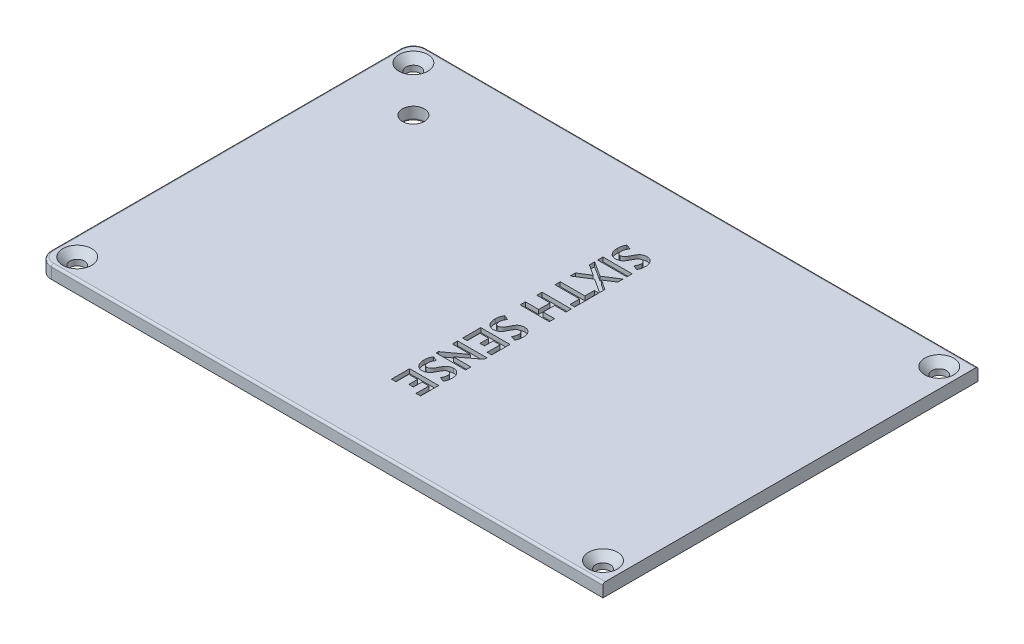
from build123d import *

# Parameters (mm, degrees)
SKETCH1_W                    = 131
SKETCH1_H                    = 87
BOSS_EXTRUDE1_DEPTH          = 1.5
CSK_FOR_M3_SFHCS1_AT_2_COUNT = 2
CSK_FOR_M3_SFHCS1_AT_2_PITCH = 78
CSK_FOR_M3_SFHCS1_AT_3_COUNT = 2
CSK_FOR_M3_SFHCS1_AT_3_PITCH = 144.803314879
CSK_FOR_M3_SFHCS1_AT_4_COUNT = 2
CSK_FOR_M3_SFHCS1_AT_4_PITCH = 122
SKETCH5_R                    = 2.55
CUT_EXTRUDE1_DEPTH           = 79.686085174
FILLET3_R                    = 0.5
SKETCH6_W                    = 6.762722439
SKETCH6_H                    = 1.229585898
CUT_EXTRUDE2_DEPTH           = 1
FILLET4_R                    = 3
FILLET5_R                    = 0.5


with BuildPart() as part:
    # Sketch1 → Boss-Extrude1 (new, symmetric)
    with BuildSketch(Plane(origin=(0, 0, 0), x_dir=(1, 0, 0), z_dir=(0, 1, 0))):
        Rectangle(SKETCH1_W, SKETCH1_H)
    extrude(amount=BOSS_EXTRUDE1_DEPTH, both=True)

    # Sketch4 → CSK for M3 SFHCS1 (revolve, cut)
    with BuildSketch(Plane(origin=(-61, 1.5, -39), x_dir=(0, 0, 1), z_dir=(1, 0, 0))):
        Polygon((0, 0), (0, 3), (1.7, 3), (1.7, 1.66), (3.36, 0), align=None)
    csk_for_m3_sfhcs1 = revolve(axis=Axis((-61, 7.85, -39), (0, -1, 0)), mode=Mode.SUBTRACT)

    # CSK for M3 SFHCS1 at 2: CSK for M3 SFHCS1 ×2
    with Locations(*[(0, 0, i * CSK_FOR_M3_SFHCS1_AT_2_PITCH) for i in range(1, CSK_FOR_M3_SFHCS1_AT_2_COUNT)]):
        add(csk_for_m3_sfhcs1, mode=Mode.SUBTRACT)

    # CSK for M3 SFHCS1 at 3: CSK for M3 SFHCS1 ×2
    with Locations(*[Vector(0.8425221487628959, 0, 0.5386617016680811) * (i * CSK_FOR_M3_SFHCS1_AT_3_PITCH) for i in range(1, CSK_FOR_M3_SFHCS1_AT_3_COUNT)]):
        add(csk_for_m3_sfhcs1, mode=Mode.SUBTRACT)

    # CSK for M3 SFHCS1 at 4: CSK for M3 SFHCS1 ×2
    with Locations(*[(i * CSK_FOR_M3_SFHCS1_AT_4_PITCH, 0, 0) for i in range(1, CSK_FOR_M3_SFHCS1_AT_4_COUNT)]):
        add(csk_for_m3_sfhcs1, mode=Mode.SUBTRACT)

    # Sketch5 → Cut-Extrude1 (cut, through all)
    with BuildSketch(Plane(origin=(0, 1.5, 0), x_dir=(1, 0, 0), z_dir=(0, 1, 0))):
        with Locations(Location((-50.5, 28.5, 0), (0, 0, 270))):
            Circle(SKETCH5_R)
    extrude(amount=-CUT_EXTRUDE1_DEPTH, mode=Mode.SUBTRACT)

    # Fillet3
    fillet3_edges = [part.edges().sort_by_distance(p)[0] for p in [
        (-50.5, -1.5, -31.05),
    ]]
    fillet(fillet3_edges, radius=FILLET3_R)

    # Sketch6 → Cut-Extrude2 (cut)
    with BuildSketch(Plane(origin=(0, 1.5, 0), x_dir=(1, 0, 0), z_dir=(0, 1, 0))):
        with BuildLine():
            Line((0.406202484, 27.182631103), (1.49306859, 26.739376365))
            add(Edge.make_bspline(
                [(1.49306859, 26.739376365), (1.451060698, 26.680928639), (1.368792763, 26.566465061), (1.26222519, 26.389008384), (1.170583404, 26.212893324), (1.096407357, 26.037079675), (1.038197761, 25.862314249), (0.996753307, 25.688342194), (0.970908871, 25.514686568), (0.967700298, 25.398720088), (0.966103206, 25.340996867)],
                knots=[0, 0, 0, 0, 1.136007301, 2.224747964, 3.264852221, 4.268199212, 5.234281408, 6.169723066, 7.088965376, 8, 8, 8, 8], degree=3))
            add(Edge.make_bspline(
                [(0.966103206, 25.340996867), (0.966639685, 25.29844729), (0.967679109, 25.216007943), (0.975413127, 25.095857576), (0.991112368, 24.984271883), (1.009318959, 24.880302518), (1.035554037, 24.785355631), (1.067531045, 24.699016346), (1.102048587, 24.618995415), (1.147400367, 24.549650023), (1.194339423, 24.485719752), (1.248915921, 24.431139206), (1.309491409, 24.38630681), (1.374984108, 24.348112967), (1.446770748, 24.31962439), (1.524152146, 24.2990936), (1.607017728, 24.286516132), (1.664104215, 24.285066204), (1.693425221, 24.284321486)],
                knots=[0, 0, 0, 0, 1.401841713, 2.716053132, 3.962869092, 5.112648236, 6.191186144, 7.201893328, 8.146031284, 9.053370396, 9.924442017, 10.755622299, 11.584476831, 12.401325343, 13.246460079, 14.120135028, 15.034455693, 16, 16, 16, 16], degree=3))
            add(Edge.make_bspline(
                [(1.693425221, 24.284321486), (1.750079425, 24.28691381), (1.863639895, 24.29210999), (2.029550149, 24.34484128), (2.192463764, 24.421809608), (2.322558495, 24.513717075), (2.425178797, 24.60740506), (2.505812559, 24.69604494), (2.589495448, 24.800343015), (2.674201792, 24.921969072), (2.761874097, 25.059431468), (2.852468863, 25.212997728), (2.944004992, 25.383747509), (3.036181592, 25.565959993), (3.125218667, 25.749964235), (3.216621044, 25.920636033), (3.301160036, 26.077018458), (3.383559625, 26.216041169), (3.459996448, 26.340161777), (3.532794568, 26.448115022), (3.602282068, 26.539494871), (3.688138749, 26.640873514), (3.800498416, 26.747895184), (3.943401171, 26.861927268), (4.100019614, 26.958165656), (4.267428916, 27.038834692), (4.4453598, 27.104579727), (4.633504574, 27.148483504), (4.830548805, 27.177266557), (4.964896301, 27.180815672), (5.03361727, 27.182631103)],
                knots=[0, 0, 0, 0, 1.007299351, 2.019080297, 3.077118061, 4.213121693, 4.842470732, 5.552493502, 6.347401472, 7.225468917, 8.193906372, 9.254299695, 10.403955714, 11.647898709, 12.895473506, 14.048481298, 15.099832135, 16.065104079, 16.929732481, 17.698947541, 18.385773577, 18.975893792, 20.0661414, 21.146426602, 22.230677068, 23.336076148, 24.455976316, 25.605429759, 26.775137678, 28, 28, 28, 28], degree=3))
            add(Edge.make_bspline(
                [(5.03361727, 27.182631103), (5.097742256, 27.18062916), (5.22332768, 27.176708459), (5.407950359, 27.150441727), (5.583749307, 27.105274761), (5.751506362, 27.041243327), (5.911050633, 26.960432483), (6.062182492, 26.860634244), (6.203188675, 26.74160486), (6.335955733, 26.60788024), (6.456356714, 26.459882115), (6.562791017, 26.300325063), (6.651528005, 26.129757444), (6.725494661, 25.94949257), (6.781056399, 25.758914882), (6.820553846, 25.558194292), (6.846184974, 25.347603991), (6.849073436, 25.20338554), (6.850550003, 25.129661791)],
                knots=[0, 0, 0, 0, 1.003085556, 1.964490506, 2.910404148, 3.836734481, 4.768026743, 5.702831464, 6.663037238, 7.649755293, 8.64667032, 9.64299446, 10.644854062, 11.649469957, 12.686516093, 13.74467873, 14.84709108, 16, 16, 16, 16], degree=3))
            add(Edge.make_bspline(
                [(6.850550003, 25.129661791), (6.849282159, 25.034940665), (6.846835104, 24.852120249), (6.826767079, 24.587527634), (6.790575351, 24.342974118), (6.744126247, 24.116685217), (6.680394544, 23.910406447), (6.605587743, 23.722231023), (6.516079834, 23.553107756), (6.44195876, 23.45415445), (6.40592296, 23.406045845)],
                knots=[0, 0, 0, 0, 1.254174961, 2.420672123, 3.510267823, 4.525993671, 5.476313664, 6.364885099, 7.205048305, 8, 8, 8, 8], degree=3))
            Line((6.40592296, 23.406045845), (5.357481413, 23.766962241))
            add(Edge.make_bspline(
                [(5.357481413, 23.766962241), (5.392596173, 23.81906428), (5.461942779, 23.921958321), (5.550608739, 24.082968582), (5.626600455, 24.245141428), (5.688862247, 24.409282435), (5.737139041, 24.575865514), (5.771218197, 24.744775686), (5.792739106, 24.915940589), (5.795321759, 25.030792979), (5.796619234, 25.088492621)],
                knots=[0, 0, 0, 0, 1.065306581, 2.103827425, 3.113989297, 4.101151914, 5.078507631, 6.052407603, 7.021566866, 8, 8, 8, 8], degree=3))
            add(Edge.make_bspline(
                [(5.796619234, 25.088492621), (5.794168994, 25.153661255), (5.789526802, 25.277128913), (5.749869292, 25.451777373), (5.680658704, 25.602846957), (5.584926002, 25.729206663), (5.468104007, 25.82947978), (5.333590596, 25.902379752), (5.181773991, 25.946280366), (5.07508475, 25.950738832), (5.019894213, 25.953045205)],
                knots=[0, 0, 0, 0, 1.191848157, 2.258060239, 3.254500576, 4.210660285, 5.136954709, 6.051060518, 6.991810101, 8, 8, 8, 8], degree=3))
            add(Edge.make_bspline(
                [(5.019894213, 25.953045205), (4.971290184, 25.948700173), (4.87009389, 25.939653575), (4.721130463, 25.873271238), (4.573630958, 25.768747461), (4.424872882, 25.624501793), (4.276303466, 25.439999622), (4.12560074, 25.216056249), (3.973783292, 24.951967842), (3.878834428, 24.759269525), (3.828732874, 24.657588634)],
                knots=[0, 0, 0, 0, 0.634420533, 1.320898859, 2.099052417, 2.991721158, 4.020274054, 5.191524251, 6.518054955, 8, 8, 8, 8], degree=3))
            add(Edge.make_bspline(
                [(3.828732874, 24.657588634), (3.801939633, 24.60260168), (3.749874534, 24.495750063), (3.67118765, 24.342405803), (3.591901355, 24.202311173), (3.517159255, 24.072264204), (3.441633348, 23.955196737), (3.369247523, 23.848861411), (3.298035831, 23.755181164), (3.205113446, 23.647993276), (3.084873077, 23.52884348), (2.929991075, 23.403363219), (2.76249345, 23.297314812), (2.584779241, 23.208765881), (2.395523041, 23.139928396), (2.195830387, 23.091075486), (1.98535845, 23.059467839), (1.841294043, 23.056338092), (1.767529728, 23.054735588)],
                knots=[0, 0, 0, 0, 1.052076341, 2.044413247, 2.963730473, 3.820594687, 4.623762047, 5.359219194, 6.032729248, 6.646314003, 7.797940816, 8.939444724, 10.067858809, 11.200844217, 12.34827075, 13.52373162, 14.73209321, 16, 16, 16, 16], degree=3))
            add(Edge.make_bspline(
                [(1.767529728, 23.054735588), (1.701516125, 23.05626675), (1.571442494, 23.059283762), (1.38150153, 23.092533933), (1.199860181, 23.142911532), (1.027440717, 23.214717961), (0.864253006, 23.307285013), (0.711445445, 23.42133194), (0.565957669, 23.554031363), (0.431403321, 23.7069431), (0.309212511, 23.877518639), (0.202041591, 24.062519517), (0.112766412, 24.262479767), (0.038353803, 24.474802474), (-0.017270218, 24.702022622), (-0.058335708, 24.942265837), (-0.083370092, 25.196833462), (-0.086317962, 25.371130242), (-0.087827564, 25.460387462)],
                knots=[0, 0, 0, 0, 0.930401173, 1.833268491, 2.711750648, 3.585455244, 4.461159603, 5.351765821, 6.269910703, 7.234595455, 8.219615877, 9.225803062, 10.245394606, 11.304653431, 12.395600179, 13.541437022, 14.740972164, 16, 16, 16, 16], degree=3))
            add(Edge.make_bspline(
                [(-0.087827564, 25.460387462), (-0.086190768, 25.539125064), (-0.082957515, 25.694659749), (-0.058874425, 25.924836778), (-0.02054526, 26.149044867), (0.032680534, 26.368085752), (0.103255024, 26.581124016), (0.188291788, 26.788492426), (0.288447906, 26.990091967), (0.366811534, 27.118223421), (0.406202484, 27.182631103)],
                knots=[0, 0, 0, 0, 1.040147641, 2.054660472, 3.05421144, 4.043643693, 5.029821955, 6.016352017, 7.002882079, 8, 8, 8, 8], degree=3))
        make_face()
        with Locations((3.38136122, 21.38601187)):
            Rectangle(SKETCH6_W, SKETCH6_H)
        Polygon((0, 15.589392636), (2.527787081, 17.197734904), (0, 18.839012509), (0, 20.068598407), (3.489773369, 17.809783242), (6.762722439, 19.892943279), (6.758605522, 18.663357381), (4.454504269, 17.185384153), (6.762722439, 15.6772202), (6.762722439, 14.447634302), (3.489773369, 16.573335815), (0, 14.359806738), align=None)
        Polygon((5.708791669, 10.846704172), (0, 10.846704172), (0, 12.07629007), (5.708791669, 12.07629007), (5.708791669, 14.271979174), (6.762722439, 14.271979174), (6.762722439, 8.651015068), (5.708791669, 8.651015068), align=None)
        Polygon((0, 3.996154169), (3.073964745, 3.996154169), (3.073964745, 6.630981093), (0, 6.630981093), (0, 7.860566991), (6.762722439, 7.860566991), (6.762722439, 6.630981093), (4.127895515, 6.630981093), (4.127895515, 3.996154169), (6.762722439, 3.996154169), (6.762722439, 2.766568271), (0, 2.766568271), align=None)
        with BuildLine():
            Line((0.406202484, -1.185672116), (1.49306859, -1.628926854))
            add(Edge.make_bspline(
                [(1.49306859, -1.628926854), (1.451060698, -1.68737458), (1.368792763, -1.801838158), (1.26222519, -1.979294835), (1.170583404, -2.155409895), (1.096407357, -2.331223544), (1.038197761, -2.50598897), (0.996753307, -2.679961025), (0.970908871, -2.853616651), (0.967700298, -2.969583131), (0.966103206, -3.027306352)],
                knots=[0, 0, 0, 0, 1.136007301, 2.224747964, 3.264852221, 4.268199212, 5.234281408, 6.169723066, 7.088965376, 8, 8, 8, 8], degree=3))
            add(Edge.make_bspline(
                [(0.966103206, -3.027306352), (0.966639685, -3.06985593), (0.967679109, -3.152295276), (0.975413127, -3.272445643), (0.991112368, -3.384031336), (1.009318959, -3.488000701), (1.035554037, -3.582947588), (1.067531045, -3.669286873), (1.102048587, -3.749307804), (1.147400367, -3.818653196), (1.194339423, -3.882583467), (1.248915921, -3.937164013), (1.309491409, -3.981996409), (1.374984108, -4.020190252), (1.446770748, -4.048678829), (1.524152146, -4.069209619), (1.607017728, -4.081787087), (1.664104215, -4.083237015), (1.693425221, -4.083981733)],
                knots=[0, 0, 0, 0, 1.401841713, 2.716053132, 3.962869092, 5.112648236, 6.191186144, 7.201893328, 8.146031284, 9.053370396, 9.924442017, 10.755622299, 11.584476831, 12.401325343, 13.246460079, 14.120135028, 15.034455693, 16, 16, 16, 16], degree=3))
            add(Edge.make_bspline(
                [(1.693425221, -4.083981733), (1.750079425, -4.08138941), (1.863639895, -4.076193229), (2.029550149, -4.023461939), (2.192463764, -3.946493611), (2.322558495, -3.854586144), (2.425178797, -3.760898159), (2.505812559, -3.672258279), (2.589495448, -3.567960204), (2.674201792, -3.446334147), (2.761874097, -3.308871751), (2.852468863, -3.155305491), (2.944004992, -2.98455571), (3.036181592, -2.802343226), (3.125218667, -2.618338984), (3.216621044, -2.447667186), (3.301160036, -2.291284761), (3.383559625, -2.15226205), (3.459996448, -2.028141442), (3.532794568, -1.920188197), (3.602282068, -1.828808348), (3.688138749, -1.727429705), (3.800498416, -1.620408035), (3.943401171, -1.506375951), (4.100019614, -1.410137563), (4.267428916, -1.329468527), (4.4453598, -1.263723492), (4.633504574, -1.219819715), (4.830548805, -1.191036662), (4.964896301, -1.187487547), (5.03361727, -1.185672116)],
                knots=[0, 0, 0, 0, 1.007299351, 2.019080297, 3.077118061, 4.213121693, 4.842470732, 5.552493502, 6.347401472, 7.225468917, 8.193906372, 9.254299695, 10.403955714, 11.647898709, 12.895473506, 14.048481298, 15.099832135, 16.065104079, 16.929732481, 17.698947541, 18.385773577, 18.975893792, 20.0661414, 21.146426602, 22.230677068, 23.336076148, 24.455976316, 25.605429759, 26.775137678, 28, 28, 28, 28], degree=3))
            add(Edge.make_bspline(
                [(5.03361727, -1.185672116), (5.097742256, -1.187674059), (5.22332768, -1.19159476), (5.407950359, -1.217861492), (5.583749307, -1.263028458), (5.751506362, -1.327059892), (5.911050633, -1.407870736), (6.062182492, -1.507668975), (6.203188675, -1.626698359), (6.335955733, -1.760422979), (6.456356714, -1.908421104), (6.562791017, -2.067978156), (6.651528005, -2.238545775), (6.725494661, -2.41881065), (6.781056399, -2.609388337), (6.820553846, -2.810108927), (6.846184974, -3.020699228), (6.849073436, -3.164917679), (6.850550003, -3.238641428)],
                knots=[0, 0, 0, 0, 1.003085556, 1.964490506, 2.910404148, 3.836734481, 4.768026743, 5.702831464, 6.663037238, 7.649755293, 8.64667032, 9.64299446, 10.644854062, 11.649469957, 12.686516093, 13.74467873, 14.84709108, 16, 16, 16, 16], degree=3))
            add(Edge.make_bspline(
                [(6.850550003, -3.238641428), (6.849282159, -3.333362554), (6.846835104, -3.51618297), (6.826767079, -3.780775585), (6.790575351, -4.025329101), (6.744126247, -4.251618002), (6.680394544, -4.457896773), (6.605587743, -4.646072196), (6.516079834, -4.815195463), (6.44195876, -4.914148769), (6.40592296, -4.962257374)],
                knots=[0, 0, 0, 0, 1.254174961, 2.420672123, 3.510267823, 4.525993671, 5.476313664, 6.364885099, 7.205048305, 8, 8, 8, 8], degree=3))
            Line((6.40592296, -4.962257374), (5.357481413, -4.601340978))
            add(Edge.make_bspline(
                [(5.357481413, -4.601340978), (5.392596173, -4.549238939), (5.461942779, -4.446344898), (5.550608739, -4.285334637), (5.626600455, -4.123161792), (5.688862247, -3.959020784), (5.737139041, -3.792437705), (5.771218197, -3.623527533), (5.792739106, -3.45236263), (5.795321759, -3.33751024), (5.796619234, -3.279810599)],
                knots=[0, 0, 0, 0, 1.065306581, 2.103827425, 3.113989297, 4.101151914, 5.078507631, 6.052407603, 7.021566866, 8, 8, 8, 8], degree=3))
            add(Edge.make_bspline(
                [(5.796619234, -3.279810599), (5.794168994, -3.214641965), (5.789526802, -3.091174306), (5.749869292, -2.916525847), (5.680658704, -2.765456263), (5.584926002, -2.639096556), (5.468104007, -2.538823439), (5.333590596, -2.465923467), (5.181773991, -2.422022853), (5.07508475, -2.417564387), (5.019894213, -2.415258014)],
                knots=[0, 0, 0, 0, 1.191848157, 2.258060239, 3.254500576, 4.210660285, 5.136954709, 6.051060518, 6.991810101, 8, 8, 8, 8], degree=3))
            add(Edge.make_bspline(
                [(5.019894213, -2.415258014), (4.971290184, -2.419603046), (4.87009389, -2.428649644), (4.721130463, -2.495031981), (4.573630958, -2.599555758), (4.424872882, -2.743801426), (4.276303466, -2.928303597), (4.12560074, -3.152246971), (3.973783292, -3.416335377), (3.878834428, -3.609033694), (3.828732874, -3.710714585)],
                knots=[0, 0, 0, 0, 0.634420533, 1.320898859, 2.099052417, 2.991721158, 4.020274054, 5.191524251, 6.518054955, 8, 8, 8, 8], degree=3))
            add(Edge.make_bspline(
                [(3.828732874, -3.710714585), (3.801939633, -3.76570154), (3.749874534, -3.872553157), (3.67118765, -4.025897416), (3.591901355, -4.165992047), (3.517159255, -4.296039016), (3.441633348, -4.413106482), (3.369247523, -4.519441809), (3.298035831, -4.613122055), (3.205113446, -4.720309943), (3.084873077, -4.839459739), (2.929991075, -4.96494), (2.76249345, -5.070988407), (2.584779241, -5.159537338), (2.395523041, -5.228374823), (2.195830387, -5.277227733), (1.98535845, -5.30883538), (1.841294043, -5.311965128), (1.767529728, -5.313567631)],
                knots=[0, 0, 0, 0, 1.052076341, 2.044413247, 2.963730473, 3.820594687, 4.623762047, 5.359219194, 6.032729248, 6.646314003, 7.797940816, 8.939444724, 10.067858809, 11.200844217, 12.34827075, 13.52373162, 14.73209321, 16, 16, 16, 16], degree=3))
            add(Edge.make_bspline(
                [(1.767529728, -5.313567631), (1.701516125, -5.312036469), (1.571442494, -5.309019458), (1.38150153, -5.275769286), (1.199860181, -5.225391687), (1.027440717, -5.153585258), (0.864253006, -5.061018207), (0.711445445, -4.946971279), (0.565957669, -4.814271856), (0.431403321, -4.661360119), (0.309212511, -4.49078458), (0.202041591, -4.305783703), (0.112766412, -4.105823453), (0.038353803, -3.893500745), (-0.017270218, -3.666280597), (-0.058335708, -3.426037382), (-0.083370092, -3.171469757), (-0.086317962, -2.997172977), (-0.087827564, -2.907915757)],
                knots=[0, 0, 0, 0, 0.930401173, 1.833268491, 2.711750648, 3.585455244, 4.461159603, 5.351765821, 6.269910703, 7.234595455, 8.219615877, 9.225803062, 10.245394606, 11.304653431, 12.395600179, 13.541437022, 14.740972164, 16, 16, 16, 16], degree=3))
            add(Edge.make_bspline(
                [(-0.087827564, -2.907915757), (-0.086190768, -2.829178156), (-0.082957515, -2.67364347), (-0.058874425, -2.443466441), (-0.02054526, -2.219258352), (0.032680534, -2.000217467), (0.103255024, -1.787179203), (0.188291788, -1.579810794), (0.288447906, -1.378211252), (0.366811534, -1.250079798), (0.406202484, -1.185672116)],
                knots=[0, 0, 0, 0, 1.040147641, 2.054660472, 3.05421144, 4.043643693, 5.029821955, 6.016352017, 7.002882079, 8, 8, 8, 8], degree=3))
        make_face()
        Polygon((5.708791669, -7.597084299), (4.127895515, -7.597084299), (4.127895515, -9.617118274), (3.073964745, -9.617118274), (3.073964745, -7.597084299), (1.05393077, -7.597084299), (1.05393077, -10.58322148), (0, -10.58322148), (0, -6.367498401), (6.762722439, -6.367498401), (6.762722439, -10.58322148), (5.708791669, -10.58322148), align=None)
        Polygon((-0.087827564, -16.116358021), (4.215723079, -12.954565712), (0, -12.954565712), (0, -11.724979813), (6.762722439, -11.724979813), (6.762722439, -12.339772763), (2.722654489, -15.413737508), (6.762722439, -15.413737508), (6.762722439, -16.643323406), (-0.087827564, -16.643323406), align=None)
        with BuildLine():
            Line((0.406202484, -17.697254175), (1.49306859, -18.140508913))
            add(Edge.make_bspline(
                [(1.49306859, -18.140508913), (1.451060698, -18.19895664), (1.368792763, -18.313420218), (1.26222519, -18.490876895), (1.170583404, -18.666991955), (1.096407357, -18.842805603), (1.038197761, -19.01757103), (0.996753307, -19.191543085), (0.970908871, -19.365198711), (0.967700298, -19.481165191), (0.966103206, -19.538888411)],
                knots=[0, 0, 0, 0, 1.136007301, 2.224747964, 3.264852221, 4.268199212, 5.234281408, 6.169723066, 7.088965376, 8, 8, 8, 8], degree=3))
            add(Edge.make_bspline(
                [(0.966103206, -19.538888411), (0.966639685, -19.581437989), (0.967679109, -19.663877335), (0.975413127, -19.784027702), (0.991112368, -19.895613396), (1.009318959, -19.999582761), (1.035554037, -20.094529648), (1.067531045, -20.180868932), (1.102048587, -20.260889863), (1.147400367, -20.330235256), (1.194339423, -20.394165526), (1.248915921, -20.448746073), (1.309491409, -20.493578469), (1.374984108, -20.531772311), (1.446770748, -20.560260889), (1.524152146, -20.580791679), (1.607017728, -20.593369146), (1.664104215, -20.594819074), (1.693425221, -20.595563792)],
                knots=[0, 0, 0, 0, 1.401841713, 2.716053132, 3.962869092, 5.112648236, 6.191186144, 7.201893328, 8.146031284, 9.053370396, 9.924442017, 10.755622299, 11.584476831, 12.401325343, 13.246460079, 14.120135028, 15.034455693, 16, 16, 16, 16], degree=3))
            add(Edge.make_bspline(
                [(1.693425221, -20.595563792), (1.750079425, -20.592971469), (1.863639895, -20.587775289), (2.029550149, -20.535043999), (2.192463764, -20.45807567), (2.322558495, -20.366168203), (2.425178797, -20.272480219), (2.505812559, -20.183840339), (2.589495448, -20.079542264), (2.674201792, -19.957916206), (2.761874097, -19.82045381), (2.852468863, -19.666887551), (2.944004992, -19.49613777), (3.036181592, -19.313925286), (3.125218667, -19.129921043), (3.216621044, -18.959249246), (3.301160036, -18.80286682), (3.383559625, -18.663844109), (3.459996448, -18.539723502), (3.532794568, -18.431770256), (3.602282068, -18.340390408), (3.688138749, -18.239011764), (3.800498416, -18.131990095), (3.943401171, -18.01795801), (4.100019614, -17.921719623), (4.267428916, -17.841050586), (4.4453598, -17.775305552), (4.633504574, -17.731401774), (4.830548805, -17.702618721), (4.964896301, -17.699069606), (5.03361727, -17.697254175)],
                knots=[0, 0, 0, 0, 1.007299351, 2.019080297, 3.077118061, 4.213121693, 4.842470732, 5.552493502, 6.347401472, 7.225468917, 8.193906372, 9.254299695, 10.403955714, 11.647898709, 12.895473506, 14.048481298, 15.099832135, 16.065104079, 16.929732481, 17.698947541, 18.385773577, 18.975893792, 20.0661414, 21.146426602, 22.230677068, 23.336076148, 24.455976316, 25.605429759, 26.775137678, 28, 28, 28, 28], degree=3))
            add(Edge.make_bspline(
                [(5.03361727, -17.697254175), (5.097742256, -17.699256119), (5.22332768, -17.703176819), (5.407950359, -17.729443552), (5.583749307, -17.774610518), (5.751506362, -17.838641952), (5.911050633, -17.919452796), (6.062182492, -18.019251034), (6.203188675, -18.138280418), (6.335955733, -18.272005038), (6.456356714, -18.420003164), (6.562791017, -18.579560216), (6.651528005, -18.750127834), (6.725494661, -18.930392709), (6.781056399, -19.120970396), (6.820553846, -19.321690986), (6.846184974, -19.532281288), (6.849073436, -19.676499739), (6.850550003, -19.750223487)],
                knots=[0, 0, 0, 0, 1.003085556, 1.964490506, 2.910404148, 3.836734481, 4.768026743, 5.702831464, 6.663037238, 7.649755293, 8.64667032, 9.64299446, 10.644854062, 11.649469957, 12.686516093, 13.74467873, 14.84709108, 16, 16, 16, 16], degree=3))
            add(Edge.make_bspline(
                [(6.850550003, -19.750223487), (6.849282159, -19.844944613), (6.846835104, -20.027765029), (6.826767079, -20.292357644), (6.790575351, -20.536911161), (6.744126247, -20.763200062), (6.680394544, -20.969478832), (6.605587743, -21.157654255), (6.516079834, -21.326777523), (6.44195876, -21.425730828), (6.40592296, -21.473839434)],
                knots=[0, 0, 0, 0, 1.254174961, 2.420672123, 3.510267823, 4.525993671, 5.476313664, 6.364885099, 7.205048305, 8, 8, 8, 8], degree=3))
            Line((6.40592296, -21.473839434), (5.357481413, -21.112923037))
            add(Edge.make_bspline(
                [(5.357481413, -21.112923037), (5.392596173, -21.060820998), (5.461942779, -20.957926958), (5.550608739, -20.796916697), (5.626600455, -20.634743851), (5.688862247, -20.470602843), (5.737139041, -20.304019764), (5.771218197, -20.135109592), (5.792739106, -19.96394469), (5.795321759, -19.8490923), (5.796619234, -19.791392658)],
                knots=[0, 0, 0, 0, 1.065306581, 2.103827425, 3.113989297, 4.101151914, 5.078507631, 6.052407603, 7.021566866, 8, 8, 8, 8], degree=3))
            add(Edge.make_bspline(
                [(5.796619234, -19.791392658), (5.794168994, -19.726224024), (5.789526802, -19.602756366), (5.749869292, -19.428107906), (5.680658704, -19.277038322), (5.584926002, -19.150678615), (5.468104007, -19.050405498), (5.333590596, -18.977505526), (5.181773991, -18.933604912), (5.07508475, -18.929146446), (5.019894213, -18.926840073)],
                knots=[0, 0, 0, 0, 1.191848157, 2.258060239, 3.254500576, 4.210660285, 5.136954709, 6.051060518, 6.991810101, 8, 8, 8, 8], degree=3))
            add(Edge.make_bspline(
                [(5.019894213, -18.926840073), (4.971290184, -18.931185105), (4.87009389, -18.940231703), (4.721130463, -19.006614041), (4.573630958, -19.111137818), (4.424872882, -19.255383485), (4.276303466, -19.439885656), (4.12560074, -19.66382903), (3.973783292, -19.927917437), (3.878834428, -20.120615754), (3.828732874, -20.222296645)],
                knots=[0, 0, 0, 0, 0.634420533, 1.320898859, 2.099052417, 2.991721158, 4.020274054, 5.191524251, 6.518054955, 8, 8, 8, 8], degree=3))
            add(Edge.make_bspline(
                [(3.828732874, -20.222296645), (3.801939633, -20.277283599), (3.749874534, -20.384135216), (3.67118765, -20.537479475), (3.591901355, -20.677574106), (3.517159255, -20.807621075), (3.441633348, -20.924688542), (3.369247523, -21.031023868), (3.298035831, -21.124704114), (3.205113446, -21.231892002), (3.084873077, -21.351041798), (2.929991075, -21.47652206), (2.76249345, -21.582570467), (2.584779241, -21.671119398), (2.395523041, -21.739956883), (2.195830387, -21.788809793), (1.98535845, -21.820417439), (1.841294043, -21.823547187), (1.767529728, -21.82514969)],
                knots=[0, 0, 0, 0, 1.052076341, 2.044413247, 2.963730473, 3.820594687, 4.623762047, 5.359219194, 6.032729248, 6.646314003, 7.797940816, 8.939444724, 10.067858809, 11.200844217, 12.34827075, 13.52373162, 14.73209321, 16, 16, 16, 16], degree=3))
            add(Edge.make_bspline(
                [(1.767529728, -21.82514969), (1.701516125, -21.823618528), (1.571442494, -21.820601517), (1.38150153, -21.787351346), (1.199860181, -21.736973747), (1.027440717, -21.665167318), (0.864253006, -21.572600266), (0.711445445, -21.458553339), (0.565957669, -21.325853916), (0.431403321, -21.172942179), (0.309212511, -21.00236664), (0.202041591, -20.817365762), (0.112766412, -20.617405512), (0.038353803, -20.405082805), (-0.017270218, -20.177862656), (-0.058335708, -19.937619442), (-0.083370092, -19.683051816), (-0.086317962, -19.508755036), (-0.087827564, -19.419497816)],
                knots=[0, 0, 0, 0, 0.930401173, 1.833268491, 2.711750648, 3.585455244, 4.461159603, 5.351765821, 6.269910703, 7.234595455, 8.219615877, 9.225803062, 10.245394606, 11.304653431, 12.395600179, 13.541437022, 14.740972164, 16, 16, 16, 16], degree=3))
            add(Edge.make_bspline(
                [(-0.087827564, -19.419497816), (-0.086190768, -19.340760215), (-0.082957515, -19.185225529), (-0.058874425, -18.955048501), (-0.02054526, -18.730840412), (0.032680534, -18.511799526), (0.103255024, -18.298761262), (0.188291788, -18.091392853), (0.288447906, -17.889793311), (0.366811534, -17.761661857), (0.406202484, -17.697254175)],
                knots=[0, 0, 0, 0, 1.040147641, 2.054660472, 3.05421144, 4.043643693, 5.029821955, 6.016352017, 7.002882079, 8, 8, 8, 8], degree=3))
        make_face()
        Polygon((5.708791669, -24.108666358), (4.127895515, -24.108666358), (4.127895515, -26.128700333), (3.073964745, -26.128700333), (3.073964745, -24.108666358), (1.05393077, -24.108666358), (1.05393077, -27.094803539), (0, -27.094803539), (0, -22.87908046), (6.762722439, -22.87908046), (6.762722439, -27.094803539), (5.708791669, -27.094803539), align=None)
    extrude(amount=-CUT_EXTRUDE2_DEPTH, mode=Mode.SUBTRACT)

    # Fillet4
    fillet4_edges = [part.edges().sort_by_distance(p)[0] for p in [
        (-65.5, 0, 43.5),
        (-65.5, 0, -43.5),
    ]]
    fillet(fillet4_edges, radius=FILLET4_R)

    # Fillet5
    fillet5_edges = [part.edges().sort_by_distance(p)[0] for p in [
        (-65.5, 1.5, 0),
        (1.5, 1.5, 43.5),
        (-64.621320344, 1.5, 42.621320344),
        (-64.621320344, 1.5, -42.621320344),
        (1.5, 1.5, -43.5),
    ]]
    fillet(fillet5_edges, radius=FILLET5_R)


solid = part.part
